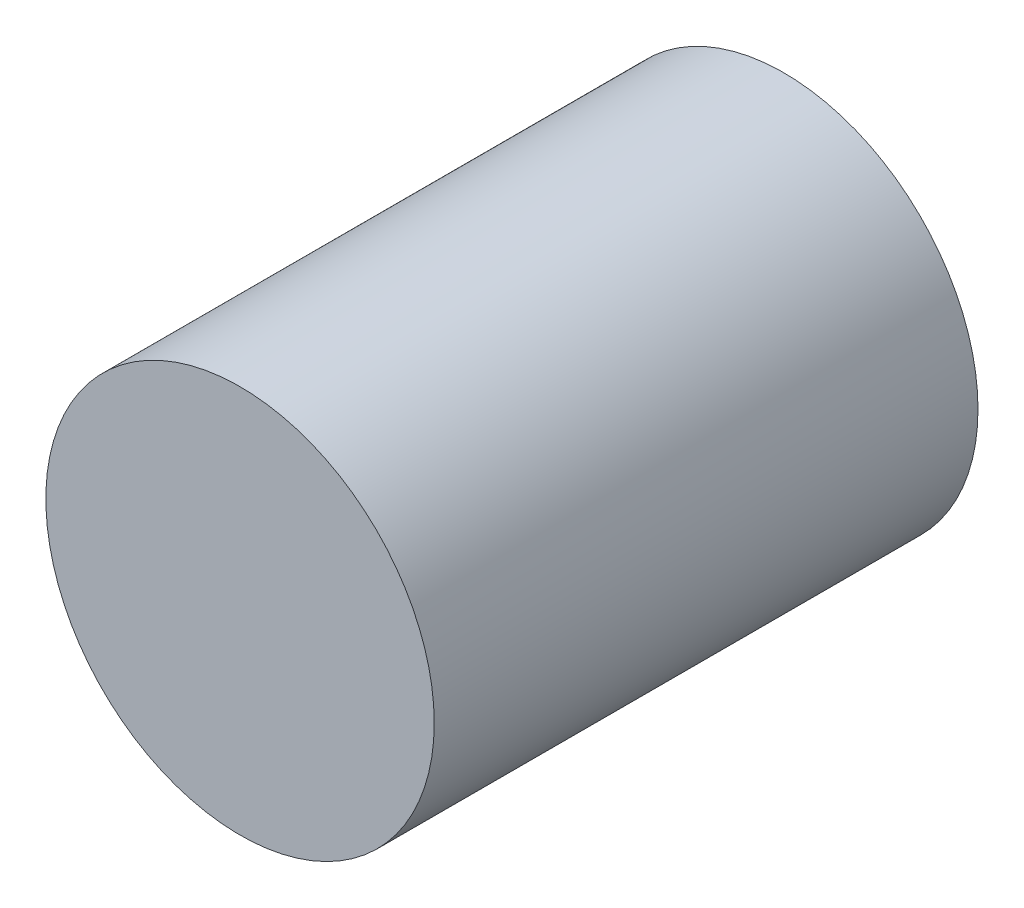
from build123d import *

# Parameters (mm, degrees)
SKETCH1_R           = 50
BOSS_EXTRUDE1_DEPTH = 70
SKETCH2_R           = 30
CUT_EXTRUDE1_DEPTH  = 40
SKETCH3_R           = 10
CUT_EXTRUDE2_DEPTH  = 80


with BuildPart() as part:
    # Sketch1 → Boss-Extrude1 (new, symmetric)
    with BuildSketch(Plane.XY):
        Circle(SKETCH1_R)
    extrude(amount=BOSS_EXTRUDE1_DEPTH, both=True)

    # Sketch2 → Cut-Extrude1 (cut)
    with BuildSketch(Plane(origin=(0, 0, -70), x_dir=(-1, 0, 0), z_dir=(0, 0, -1))):
        Circle(SKETCH2_R)
    extrude(amount=-CUT_EXTRUDE1_DEPTH, mode=Mode.SUBTRACT)

    # Sketch3 → Cut-Extrude2 (cut)
    with BuildSketch(Plane(origin=(0, 0, -30), x_dir=(-1, 0, 0), z_dir=(0, 0, -1))):
        Circle(SKETCH3_R)
    extrude(amount=-CUT_EXTRUDE2_DEPTH, mode=Mode.SUBTRACT)


solid = part.part
